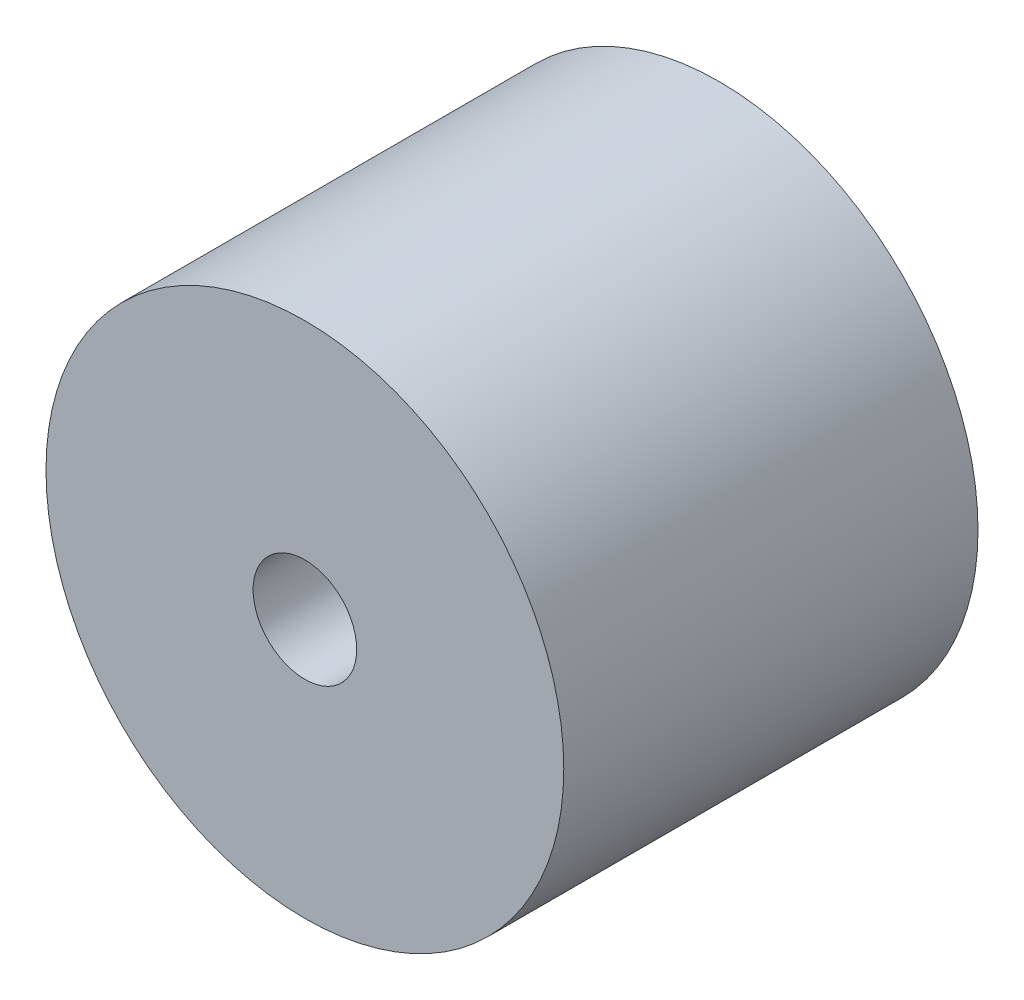
from build123d import *

# Parameters (mm, degrees)
SKETCH1_R           = 20
SKETCH1_R_2         = 4
BOSS_EXTRUDE1_DEPTH = 16


with BuildPart() as part:
    # Sketch1 → Boss-Extrude1 (new, symmetric)
    with BuildSketch(Plane.XY):
        Circle(SKETCH1_R)
        Circle(SKETCH1_R_2, mode=Mode.SUBTRACT)
    extrude(amount=BOSS_EXTRUDE1_DEPTH, both=True)


solid = part.part
